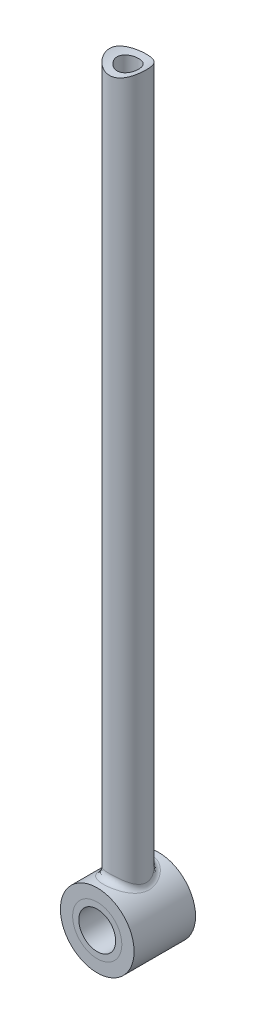
from build123d import *

# Parameters (mm, degrees)
BOSS_EXTRUDE1_DEPTH      = 57.5
BOSS_EXTRUDE1_DEPTH_BACK = 58
SKETCH1_R                = 3
SKETCH2_R                = 6
SKETCH2_R_2              = 4
SKETCH2_R_3              = 3
BOSS_EXTRUDE2_DEPTH      = 5
SKETCH3_R                = 4
SKETCH3_R_2              = 3
BOSS_EXTRUDE3_DEPTH      = 5
FILLET1_R                = 1
SKETCH5_R                = 6
CUT_EXTRUDE2_DEPTH       = 10
CUT_EXTRUDE3_DEPTH       = 58
CUT_EXTRUDE3_DEPTH_BACK  = 57
SKETCH6_R                = 1.75


with BuildPart() as part:
    # Sketch1 → Boss-Extrude1 (new, two sides: drawn at the far end of the back side and taken through both)
    with BuildSketch(Plane(origin=(0, 0, 0), x_dir=(1, 0, 0), z_dir=(0, 1, 0)).offset(-BOSS_EXTRUDE1_DEPTH_BACK)):
        with Locations(Location((0, 0, 0), (0, 0, 270))):
            Circle(SKETCH1_R)
    extrude(amount=BOSS_EXTRUDE1_DEPTH + BOSS_EXTRUDE1_DEPTH_BACK)

    # Sketch2 → Boss-Extrude2 (add, symmetric)
    # profile 1 of 2: a face of its own
    with BuildSketch(Plane.XY):
        with Locations((0, -63)):
            Circle(SKETCH2_R)
        with Locations((0, -63)):
            Circle(SKETCH2_R_2, mode=Mode.SUBTRACT)
    # profile 2 of 2: a face of its own
    with BuildSketch(Plane.XY):
        with Locations((0, 62.5)):
            Circle(SKETCH2_R)
        with Locations((0, 62.5)):
            Circle(SKETCH2_R_3, mode=Mode.SUBTRACT)
    extrude(amount=BOSS_EXTRUDE2_DEPTH, both=True)

    # Fillet1
    fillet1_edges = [part.edges().sort_by_distance(p)[0] for p in [
        (0, -57, -3.000000001),
    ]]
    fillet(fillet1_edges, radius=FILLET1_R)

    # Sketch5 → Cut-Extrude2 (cut)
    with BuildSketch(Plane.XY.offset(5)):
        with Locations((0, 62.5)):
            Circle(SKETCH5_R)
    extrude(amount=-CUT_EXTRUDE2_DEPTH, mode=Mode.SUBTRACT)

    # Sketch6 → Cut-Extrude3 (cut, two sides: drawn at the far end of the back side and taken through both)
    with BuildSketch(Plane(origin=(0, 0, 0), x_dir=(1, 0, 0), z_dir=(0, 1, 0)).offset(-CUT_EXTRUDE3_DEPTH_BACK)):
        with Locations(Location((0, 0, 0), (0, 0, 270))):
            Circle(SKETCH6_R)
    extrude(amount=CUT_EXTRUDE3_DEPTH + CUT_EXTRUDE3_DEPTH_BACK, mode=Mode.SUBTRACT)


with BuildPart() as body_2:
    # Sketch3 → Boss-Extrude3 (new, symmetric)
    with BuildSketch(Plane.XY):
        with Locations((0, -63)):
            Circle(SKETCH3_R)
        with Locations((0, -63)):
            Circle(SKETCH3_R_2, mode=Mode.SUBTRACT)
    extrude(amount=BOSS_EXTRUDE3_DEPTH, both=True)


solid = Compound([part.part, body_2.part])
